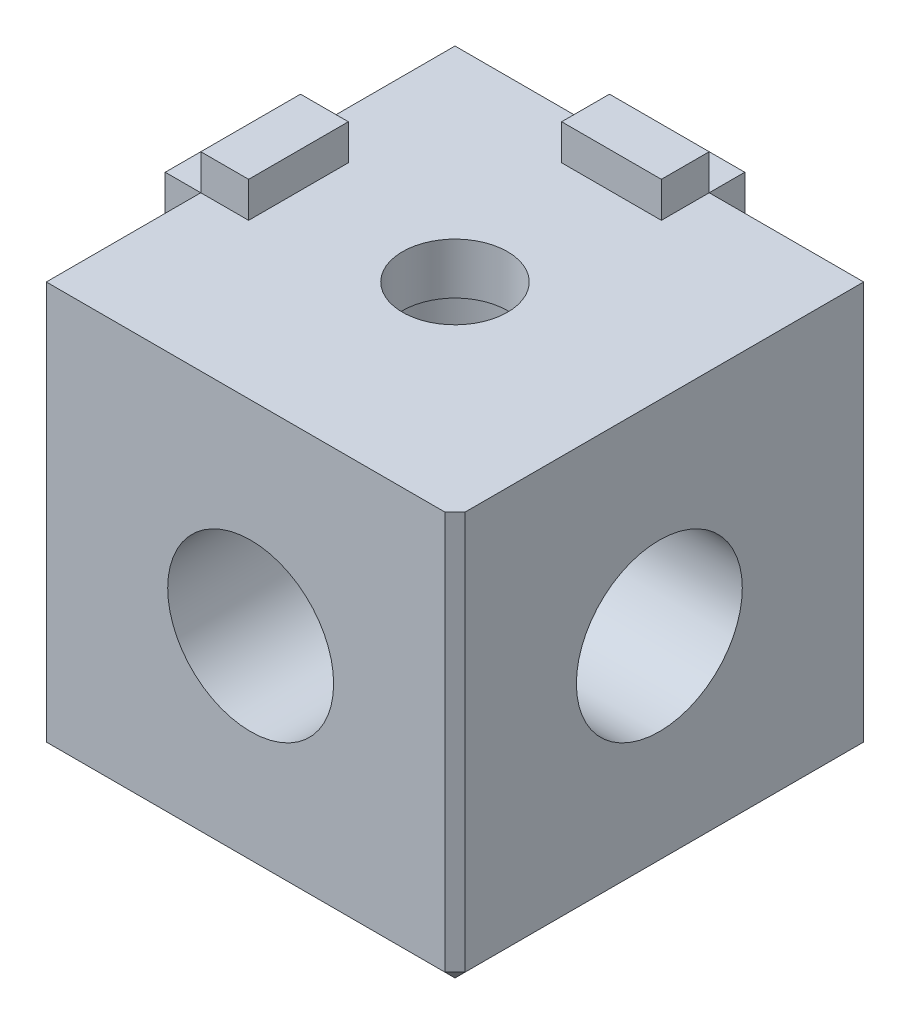
from build123d import *

# Parameters (mm, degrees)
SKETCH1_W           = 25.4
SKETCH1_H           = 25.4
BOSS_EXTRUDE1_DEPTH = 12.7
HOLE1_D             = 6.5278
HOLE1_DEPTH         = 100
HOLE1_CBORE_D       = 10.3124
HOLE1_CBORE_DEPTH   = 22.225
HOLE2_D             = 6.5278
HOLE2_DEPTH         = 100
HOLE2_CBORE_D       = 10.3124
HOLE2_CBORE_DEPTH   = 22.225
HOLE3_D             = 6.5278
HOLE3_DEPTH         = 100
HOLE3_CBORE_D       = 10.3124
HOLE3_CBORE_DEPTH   = 22.225
SKETCH8_W           = 6.1976
SKETCH8_H           = 2.9718
BOSS_EXTRUDE2_DEPTH = 2.2098
CIRPATTERN1_COUNT   = 2
CIRPATTERN1_ANGLE   = 270
SKETCH9_W           = 6.1976
SKETCH9_H           = 2.9718
BOSS_EXTRUDE3_DEPTH = 2.2098
CIRPATTERN2_COUNT   = 2
CIRPATTERN2_ANGLE   = 270
SKETCH10_W          = 2.9718
SKETCH10_H          = 6.1976
BOSS_EXTRUDE4_DEPTH = 2.2098
CIRPATTERN3_COUNT   = 2
CIRPATTERN3_ANGLE   = 90
CHAMFER1_SIZE       = 0.635


with BuildPart() as part:
    # Sketch1 → Boss-Extrude1 (new, symmetric)
    with BuildSketch(Plane.XY):
        Rectangle(SKETCH1_W, SKETCH1_H)
    extrude(amount=BOSS_EXTRUDE1_DEPTH, both=True)

    # Hole1
    with Locations(Plane.XY.offset(12.7)):
        with Locations((0, 0)):
            CounterBoreHole(HOLE1_D / 2, HOLE1_CBORE_D / 2, HOLE1_CBORE_DEPTH, depth=HOLE1_DEPTH)

    # Hole2
    with Locations(Plane(origin=(12.7, 0, 0), x_dir=(0, 0, -1), z_dir=(1, 0, 0))):
        with Locations((0, 0)):
            CounterBoreHole(HOLE2_D / 2, HOLE2_CBORE_D / 2, HOLE2_CBORE_DEPTH, depth=HOLE2_DEPTH)

    # Hole3
    with Locations(Plane.XZ.offset(12.7)):
        with Locations((0, 0)):
            CounterBoreHole(HOLE3_D / 2, HOLE3_CBORE_D / 2, HOLE3_CBORE_DEPTH, depth=HOLE3_DEPTH)

    # Sketch8 → Boss-Extrude2 (add)
    with BuildSketch(Plane(origin=(0, 12.7, 0), x_dir=(1, 0, 0), z_dir=(0, 1, 0))):
        with Locations((0, 11.2141)):
            Rectangle(SKETCH8_W, SKETCH8_H)
    boss_extrude2 = extrude(amount=BOSS_EXTRUDE2_DEPTH)

    # CirPattern1: Boss-Extrude2 ×2 about axis
    cirpattern1_axis = Axis((0, 0, 0), (0, -1, 0))
    for i in range(1, CIRPATTERN1_COUNT):
        add(boss_extrude2.rotate(cirpattern1_axis, i * CIRPATTERN1_ANGLE / (CIRPATTERN1_COUNT - 1)))

    # Sketch9 → Boss-Extrude3 (add)
    with BuildSketch(Plane.ZY.offset(12.7)):
        with Locations((0, 11.2141)):
            Rectangle(SKETCH9_W, SKETCH9_H)
    boss_extrude3 = extrude(amount=BOSS_EXTRUDE3_DEPTH)

    # CirPattern2: Boss-Extrude3 ×2 about axis
    cirpattern2_axis = Axis((0, 0, 0), (1, 0, 0))
    for i in range(1, CIRPATTERN2_COUNT):
        add(boss_extrude3.rotate(cirpattern2_axis, i * CIRPATTERN2_ANGLE / (CIRPATTERN2_COUNT - 1)))

    # Sketch10 → Boss-Extrude4 (add)
    with BuildSketch(Plane(origin=(0, 0, -12.7), x_dir=(-1, 0, 0), z_dir=(0, 0, -1))):
        with Locations((11.2141, 0)):
            Rectangle(SKETCH10_W, SKETCH10_H)
    boss_extrude4 = extrude(amount=BOSS_EXTRUDE4_DEPTH)

    # CirPattern3: Boss-Extrude4 ×2 about axis
    cirpattern3_axis = Axis((0, 0, 0), (0, 0, -1))
    for i in range(1, CIRPATTERN3_COUNT):
        add(boss_extrude4.rotate(cirpattern3_axis, i * CIRPATTERN3_ANGLE / (CIRPATTERN3_COUNT - 1)))

    # Chamfer1
    chamfer1_edges = [part.edges().sort_by_distance(p)[0] for p in [
        (0, -12.7, 12.7),
        (12.7, 0, 12.7),
        (12.7, -12.7, 0),
    ]]
    chamfer(chamfer1_edges, length=CHAMFER1_SIZE)


solid = part.part
